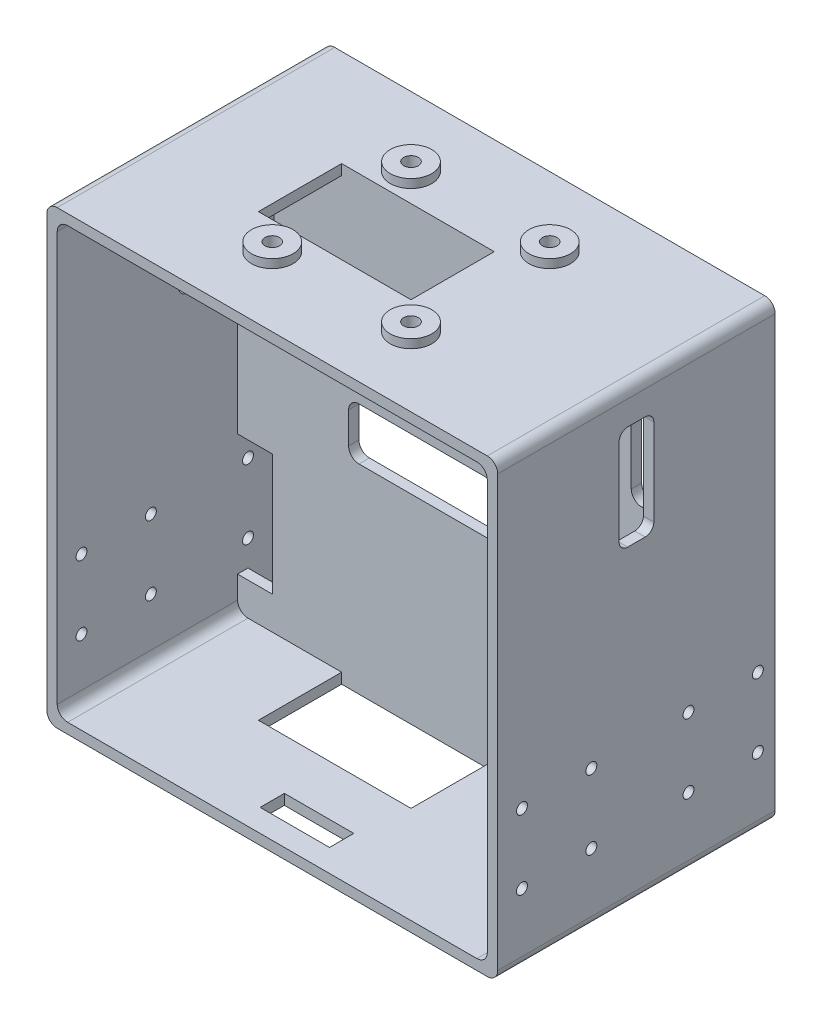
from build123d import *

# Parameters (mm, degrees)
SKETCH1_W           = 130
SKETCH1_H           = 130
SKETCH1_W_2         = 124
SKETCH1_H_2         = 124
BOSS_EXTRUDE1_DEPTH = 80
FILLET1_R           = 3
FILLET2_R           = 3
SKETCH2_W           = 44
SKETCH2_H           = 24
CUT_EXTRUDE1_DEPTH  = 166.90660023
SKETCH4_W           = 124
SKETCH4_H           = 124
BOSS_EXTRUDE4_DEPTH = 28
SKETCH3_W           = 124
SKETCH3_H           = 124
CUT_EXTRUDE2_DEPTH  = 25
FILLET3_R           = 3
SKETCH5_W           = 60
SKETCH5_H           = 15
CUT_EXTRUDE3_DEPTH  = 25
FILLET4_R           = 3
SKETCH7_W           = 10
SKETCH7_H           = 35
SKETCH7_W_2         = 7
SKETCH7_H_2         = 25
CUT_EXTRUDE4_DEPTH  = 108.121426428
FILLET6_R           = 3
CUT_EXTRUDE8_REACH  = 167.907
SKETCH8_R           = 1.575
CUT_EXTRUDE9_REACH  = 167.907
SKETCH10_R          = 1.575
SKETCH11_R          = 6
SKETCH11_R_2        = 2.1
BOSS_EXTRUDE5_DEPTH = 2.5
CUT_EXTRUDE11_REACH = 167.907
SKETCH13_R          = 2.1
SKETCH14_W          = 10
SKETCH14_H          = 30
CUT_EXTRUDE12_DEPTH = 167.901917305
FILLET7_R           = 2.5
FILLET8_R           = 2.5
CUT_EXTRUDE13_REACH = 169.873
SKETCH15_W          = 20
SKETCH15_H          = 7


with BuildPart() as part:
    # Sketch1 → Boss-Extrude1 (new body)
    with BuildSketch(Plane.XY):
        Rectangle(SKETCH1_W, SKETCH1_H)
        Rectangle(SKETCH1_W_2, SKETCH1_H_2, mode=Mode.SUBTRACT)
    extrude(amount=BOSS_EXTRUDE1_DEPTH)

    # Fillet1
    fillet1_edges = [part.edges().sort_by_distance(p)[0] for p in [
        (65, -65, 40),
        (-65, -65, 40),
        (-65, 65, 40),
        (65, 65, 40),
    ]]
    fillet(fillet1_edges, radius=FILLET1_R)

    # Fillet2
    fillet2_edges = [part.edges().sort_by_distance(p)[0] for p in [
        (62, -62, 40),
        (62, 62, 40),
        (-62, 62, 40),
        (-62, -62, 40),
    ]]
    fillet(fillet2_edges, radius=FILLET2_R)

    # Sketch2 → Cut-Extrude1 (cut, through all)
    with BuildSketch(Plane.XZ.offset(65)):
        with Locations((-10, 40)):
            Rectangle(SKETCH2_W, SKETCH2_H)
    extrude(amount=-CUT_EXTRUDE1_DEPTH, mode=Mode.SUBTRACT)

    # Sketch4 → Boss-Extrude4 (add)
    with BuildSketch(Plane(origin=(0, 0, 0), x_dir=(-1, 0, 0), z_dir=(0, 0, -1))):
        Rectangle(SKETCH4_W, SKETCH4_H)
    extrude(amount=-BOSS_EXTRUDE4_DEPTH)

    # Sketch3 → Cut-Extrude2 (cut)
    with BuildSketch(Plane(origin=(0, 0, 0), x_dir=(-1, 0, 0), z_dir=(0, 0, -1))):
        Rectangle(SKETCH3_W, SKETCH3_H)
    extrude(amount=-CUT_EXTRUDE2_DEPTH, mode=Mode.SUBTRACT)

    # Fillet3
    fillet3_edges = [part.edges().sort_by_distance(p)[0] for p in [
        (-62, 62, 12.5),
        (-62, -62, 12.5),
        (62, -62, 12.5),
        (62, 62, 12.5),
    ]]
    fillet(fillet3_edges, radius=FILLET3_R)

    # Sketch5 → Cut-Extrude3 (cut)
    with BuildSketch(Plane(origin=(0, 0, 25), x_dir=(-1, 0, 0), z_dir=(0, 0, -1))):
        Rectangle(SKETCH5_W, SKETCH5_H)
    extrude(amount=-CUT_EXTRUDE3_DEPTH, mode=Mode.SUBTRACT)

    # Fillet4
    fillet4_edges = [part.edges().sort_by_distance(p)[0] for p in [
        (-30, 7.5, 26.5),
        (-30, -7.5, 26.5),
        (30, -7.5, 26.5),
        (30, 7.5, 26.5),
    ]]
    fillet(fillet4_edges, radius=FILLET4_R)

    # Sketch7 → Cut-Extrude4 (cut, through all)
    with BuildSketch(Plane(origin=(0, 0, 25), x_dir=(-1, 0, 0), z_dir=(0, 0, -1))):
        with Locations((-57, -35)):
            Rectangle(SKETCH7_W, SKETCH7_H)
        with Locations((57, -35)):
            Rectangle(SKETCH7_W, SKETCH7_H)
        with Locations((55, 35)):
            Rectangle(SKETCH7_W_2, SKETCH7_H_2)
        with Locations((-55, 35)):
            Rectangle(SKETCH7_W_2, SKETCH7_H_2)
    extrude(amount=-CUT_EXTRUDE4_DEPTH, mode=Mode.SUBTRACT)

    # Fillet6
    fillet6_edges = [part.edges().sort_by_distance(p)[0] for p in [
        (-58.5, 47.5, 26.5),
        (-58.5, 22.5, 26.5),
        (-51.5, 22.5, 26.5),
        (-51.5, 47.5, 26.5),
        (51.5, 47.5, 26.5),
        (51.5, 22.5, 26.5),
        (58.5, 22.5, 26.5),
        (58.5, 47.5, 26.5),
    ]]
    fillet(fillet6_edges, radius=FILLET6_R)

    # Sketch8 → Cut-Extrude8 (cut, up to next)
    with BuildSketch(Plane(origin=(65, 0, 0), x_dir=(0, 0, -1), z_dir=(1, 0, 0)), mode=Mode.PRIVATE) as cut_extrude8_sk1:
        with Locations((-5, -25)):
            Circle(SKETCH8_R)
    cut_extrude8_tool1 = extrude(cut_extrude8_sk1.sketch, amount=-CUT_EXTRUDE8_REACH, mode=Mode.PRIVATE) & part.part
    # Sketch8 → Cut-Extrude8 (cut, up to next)
    with BuildSketch(Plane(origin=(65, 0, 0), x_dir=(0, 0, -1), z_dir=(1, 0, 0)), mode=Mode.PRIVATE) as cut_extrude8_sk2:
        with Locations((-5, -45)):
            Circle(SKETCH8_R)
    cut_extrude8_tool2 = extrude(cut_extrude8_sk2.sketch, amount=-CUT_EXTRUDE8_REACH, mode=Mode.PRIVATE) & part.part
    # Sketch8 → Cut-Extrude8 (cut, up to next)
    with BuildSketch(Plane(origin=(65, 0, 0), x_dir=(0, 0, -1), z_dir=(1, 0, 0)), mode=Mode.PRIVATE) as cut_extrude8_sk3:
        with Locations((-25, -25)):
            Circle(SKETCH8_R)
    cut_extrude8_tool3 = extrude(cut_extrude8_sk3.sketch, amount=-CUT_EXTRUDE8_REACH, mode=Mode.PRIVATE) & part.part
    # Sketch8 → Cut-Extrude8 (cut, up to next)
    with BuildSketch(Plane(origin=(65, 0, 0), x_dir=(0, 0, -1), z_dir=(1, 0, 0)), mode=Mode.PRIVATE) as cut_extrude8_sk4:
        with Locations((-25, -45)):
            Circle(SKETCH8_R)
    cut_extrude8_tool4 = extrude(cut_extrude8_sk4.sketch, amount=-CUT_EXTRUDE8_REACH, mode=Mode.PRIVATE) & part.part
    # Sketch8 → Cut-Extrude8 (cut, up to next)
    with BuildSketch(Plane(origin=(65, 0, 0), x_dir=(0, 0, -1), z_dir=(1, 0, 0)), mode=Mode.PRIVATE) as cut_extrude8_sk5:
        with Locations((-53, -25)):
            Circle(SKETCH8_R)
    cut_extrude8_tool5 = extrude(cut_extrude8_sk5.sketch, amount=-CUT_EXTRUDE8_REACH, mode=Mode.PRIVATE) & part.part
    # Sketch8 → Cut-Extrude8 (cut, up to next)
    with BuildSketch(Plane(origin=(65, 0, 0), x_dir=(0, 0, -1), z_dir=(1, 0, 0)), mode=Mode.PRIVATE) as cut_extrude8_sk6:
        with Locations((-53, -45)):
            Circle(SKETCH8_R)
    cut_extrude8_tool6 = extrude(cut_extrude8_sk6.sketch, amount=-CUT_EXTRUDE8_REACH, mode=Mode.PRIVATE) & part.part
    # Sketch8 → Cut-Extrude8 (cut, up to next)
    with BuildSketch(Plane(origin=(65, 0, 0), x_dir=(0, 0, -1), z_dir=(1, 0, 0)), mode=Mode.PRIVATE) as cut_extrude8_sk7:
        with Locations((-73, -25)):
            Circle(SKETCH8_R)
    cut_extrude8_tool7 = extrude(cut_extrude8_sk7.sketch, amount=-CUT_EXTRUDE8_REACH, mode=Mode.PRIVATE) & part.part
    # Sketch8 → Cut-Extrude8 (cut, up to next)
    with BuildSketch(Plane(origin=(65, 0, 0), x_dir=(0, 0, -1), z_dir=(1, 0, 0)), mode=Mode.PRIVATE) as cut_extrude8_sk8:
        with Locations((-73, -45)):
            Circle(SKETCH8_R)
    cut_extrude8_tool8 = extrude(cut_extrude8_sk8.sketch, amount=-CUT_EXTRUDE8_REACH, mode=Mode.PRIVATE) & part.part
    add(cut_extrude8_tool1.solids().sort_by_distance((65, -25, 5))[0], mode=Mode.SUBTRACT)
    add(cut_extrude8_tool2.solids().sort_by_distance((65, -45, 5))[0], mode=Mode.SUBTRACT)
    add(cut_extrude8_tool3.solids().sort_by_distance((65, -25, 25))[0], mode=Mode.SUBTRACT)
    add(cut_extrude8_tool4.solids().sort_by_distance((65, -45, 25))[0], mode=Mode.SUBTRACT)
    add(cut_extrude8_tool5.solids().sort_by_distance((65, -25, 53))[0], mode=Mode.SUBTRACT)
    add(cut_extrude8_tool6.solids().sort_by_distance((65, -45, 53))[0], mode=Mode.SUBTRACT)
    add(cut_extrude8_tool7.solids().sort_by_distance((65, -25, 73))[0], mode=Mode.SUBTRACT)
    add(cut_extrude8_tool8.solids().sort_by_distance((65, -45, 73))[0], mode=Mode.SUBTRACT)

    # Sketch10 → Cut-Extrude9 (cut, up to next)
    with BuildSketch(Plane.ZY.offset(65), mode=Mode.PRIVATE) as cut_extrude9_sk1:
        with Locations(Location((73, -25, 0), (0, 0, 180))):
            Circle(SKETCH10_R)
    cut_extrude9_tool1 = extrude(cut_extrude9_sk1.sketch, amount=-CUT_EXTRUDE9_REACH, mode=Mode.PRIVATE) & part.part
    # Sketch10 → Cut-Extrude9 (cut, up to next)
    with BuildSketch(Plane.ZY.offset(65), mode=Mode.PRIVATE) as cut_extrude9_sk2:
        with Locations(Location((73, -45, 0), (0, 0, 180))):
            Circle(SKETCH10_R)
    cut_extrude9_tool2 = extrude(cut_extrude9_sk2.sketch, amount=-CUT_EXTRUDE9_REACH, mode=Mode.PRIVATE) & part.part
    # Sketch10 → Cut-Extrude9 (cut, up to next)
    with BuildSketch(Plane.ZY.offset(65), mode=Mode.PRIVATE) as cut_extrude9_sk3:
        with Locations(Location((53, -25, 0), (0, 0, 180))):
            Circle(SKETCH10_R)
    cut_extrude9_tool3 = extrude(cut_extrude9_sk3.sketch, amount=-CUT_EXTRUDE9_REACH, mode=Mode.PRIVATE) & part.part
    # Sketch10 → Cut-Extrude9 (cut, up to next)
    with BuildSketch(Plane.ZY.offset(65), mode=Mode.PRIVATE) as cut_extrude9_sk4:
        with Locations(Location((53, -45, 0), (0, 0, 180))):
            Circle(SKETCH10_R)
    cut_extrude9_tool4 = extrude(cut_extrude9_sk4.sketch, amount=-CUT_EXTRUDE9_REACH, mode=Mode.PRIVATE) & part.part
    # Sketch10 → Cut-Extrude9 (cut, up to next)
    with BuildSketch(Plane.ZY.offset(65), mode=Mode.PRIVATE) as cut_extrude9_sk5:
        with Locations(Location((25, -25, 0), (0, 0, 180))):
            Circle(SKETCH10_R)
    cut_extrude9_tool5 = extrude(cut_extrude9_sk5.sketch, amount=-CUT_EXTRUDE9_REACH, mode=Mode.PRIVATE) & part.part
    # Sketch10 → Cut-Extrude9 (cut, up to next)
    with BuildSketch(Plane.ZY.offset(65), mode=Mode.PRIVATE) as cut_extrude9_sk6:
        with Locations(Location((25, -45, 0), (0, 0, 180))):
            Circle(SKETCH10_R)
    cut_extrude9_tool6 = extrude(cut_extrude9_sk6.sketch, amount=-CUT_EXTRUDE9_REACH, mode=Mode.PRIVATE) & part.part
    # Sketch10 → Cut-Extrude9 (cut, up to next)
    with BuildSketch(Plane.ZY.offset(65), mode=Mode.PRIVATE) as cut_extrude9_sk7:
        with Locations(Location((5, -25, 0), (0, 0, 180))):
            Circle(SKETCH10_R)
    cut_extrude9_tool7 = extrude(cut_extrude9_sk7.sketch, amount=-CUT_EXTRUDE9_REACH, mode=Mode.PRIVATE) & part.part
    # Sketch10 → Cut-Extrude9 (cut, up to next)
    with BuildSketch(Plane.ZY.offset(65), mode=Mode.PRIVATE) as cut_extrude9_sk8:
        with Locations(Location((5, -45, 0), (0, 0, 180))):
            Circle(SKETCH10_R)
    cut_extrude9_tool8 = extrude(cut_extrude9_sk8.sketch, amount=-CUT_EXTRUDE9_REACH, mode=Mode.PRIVATE) & part.part
    add(cut_extrude9_tool1.solids().sort_by_distance((-65, -25, 73))[0], mode=Mode.SUBTRACT)
    add(cut_extrude9_tool2.solids().sort_by_distance((-65, -45, 73))[0], mode=Mode.SUBTRACT)
    add(cut_extrude9_tool3.solids().sort_by_distance((-65, -25, 53))[0], mode=Mode.SUBTRACT)
    add(cut_extrude9_tool4.solids().sort_by_distance((-65, -45, 53))[0], mode=Mode.SUBTRACT)
    add(cut_extrude9_tool5.solids().sort_by_distance((-65, -25, 25))[0], mode=Mode.SUBTRACT)
    add(cut_extrude9_tool6.solids().sort_by_distance((-65, -45, 25))[0], mode=Mode.SUBTRACT)
    add(cut_extrude9_tool7.solids().sort_by_distance((-65, -25, 5))[0], mode=Mode.SUBTRACT)
    add(cut_extrude9_tool8.solids().sort_by_distance((-65, -45, 5))[0], mode=Mode.SUBTRACT)

    # Sketch11 → Boss-Extrude5 (add)
    # profile 1 of 4: a face of its own
    with BuildSketch(Plane(origin=(0, 65, 0), x_dir=(1, 0, 0), z_dir=(0, 1, 0))):
        with Locations(Location((-20, -20, 0), (0, 0, 90))):
            Circle(SKETCH11_R)
        with Locations(Location((-20, -20, 0), (0, 0, 270))):
            Circle(SKETCH11_R_2, mode=Mode.SUBTRACT)
    # profile 2 of 4: a face of its own
    with BuildSketch(Plane(origin=(0, 65, 0), x_dir=(1, 0, 0), z_dir=(0, 1, 0))):
        with Locations(Location((20, -20, 0), (0, 0, 90))):
            Circle(SKETCH11_R)
        with Locations(Location((20, -20, 0), (0, 0, 270))):
            Circle(SKETCH11_R_2, mode=Mode.SUBTRACT)
    # profile 3 of 4: a face of its own
    with BuildSketch(Plane(origin=(0, 65, 0), x_dir=(1, 0, 0), z_dir=(0, 1, 0))):
        with Locations(Location((20, -60, 0), (0, 0, 90))):
            Circle(SKETCH11_R)
        with Locations(Location((20, -60, 0), (0, 0, 270))):
            Circle(SKETCH11_R_2, mode=Mode.SUBTRACT)
    # profile 4 of 4: a face of its own
    with BuildSketch(Plane(origin=(0, 65, 0), x_dir=(1, 0, 0), z_dir=(0, 1, 0))):
        with Locations(Location((-20, -60, 0), (0, 0, 90))):
            Circle(SKETCH11_R)
        with Locations(Location((-20, -60, 0), (0, 0, 270))):
            Circle(SKETCH11_R_2, mode=Mode.SUBTRACT)
    extrude(amount=BOSS_EXTRUDE5_DEPTH)

    # Sketch13 → Cut-Extrude11 (cut, up to next)
    with BuildSketch(Plane(origin=(0, 65, 0), x_dir=(1, 0, 0), z_dir=(0, 1, 0)), mode=Mode.PRIVATE) as cut_extrude11_sk1:
        with Locations(Location((-20, -20, 0), (0, 0, 270))):
            Circle(SKETCH13_R)
    cut_extrude11_tool1 = extrude(cut_extrude11_sk1.sketch, amount=-CUT_EXTRUDE11_REACH, mode=Mode.PRIVATE) & part.part
    # Sketch13 → Cut-Extrude11 (cut, up to next)
    with BuildSketch(Plane(origin=(0, 65, 0), x_dir=(1, 0, 0), z_dir=(0, 1, 0)), mode=Mode.PRIVATE) as cut_extrude11_sk2:
        with Locations(Location((20, -20, 0), (0, 0, 270))):
            Circle(SKETCH13_R)
    cut_extrude11_tool2 = extrude(cut_extrude11_sk2.sketch, amount=-CUT_EXTRUDE11_REACH, mode=Mode.PRIVATE) & part.part
    # Sketch13 → Cut-Extrude11 (cut, up to next)
    with BuildSketch(Plane(origin=(0, 65, 0), x_dir=(1, 0, 0), z_dir=(0, 1, 0)), mode=Mode.PRIVATE) as cut_extrude11_sk3:
        with Locations(Location((20, -60, 0), (0, 0, 90))):
            Circle(SKETCH13_R)
    cut_extrude11_tool3 = extrude(cut_extrude11_sk3.sketch, amount=-CUT_EXTRUDE11_REACH, mode=Mode.PRIVATE) & part.part
    # Sketch13 → Cut-Extrude11 (cut, up to next)
    with BuildSketch(Plane(origin=(0, 65, 0), x_dir=(1, 0, 0), z_dir=(0, 1, 0)), mode=Mode.PRIVATE) as cut_extrude11_sk4:
        with Locations(Location((-20, -60, 0), (0, 0, 90))):
            Circle(SKETCH13_R)
    cut_extrude11_tool4 = extrude(cut_extrude11_sk4.sketch, amount=-CUT_EXTRUDE11_REACH, mode=Mode.PRIVATE) & part.part
    add(cut_extrude11_tool1.solids().sort_by_distance((-20, 65, 20))[0], mode=Mode.SUBTRACT)
    add(cut_extrude11_tool2.solids().sort_by_distance((20, 65, 20))[0], mode=Mode.SUBTRACT)
    add(cut_extrude11_tool3.solids().sort_by_distance((20, 65, 60))[0], mode=Mode.SUBTRACT)
    add(cut_extrude11_tool4.solids().sort_by_distance((-20, 65, 60))[0], mode=Mode.SUBTRACT)

    # Sketch14 → Cut-Extrude12 (cut, through all)
    with BuildSketch(Plane(origin=(65, 0, 0), x_dir=(0, 0, -1), z_dir=(1, 0, 0))):
        with Locations((-40, 40)):
            Rectangle(SKETCH14_W, SKETCH14_H)
    extrude(amount=-CUT_EXTRUDE12_DEPTH, mode=Mode.SUBTRACT)

    # Fillet7
    fillet7_edges = [part.edges().sort_by_distance(p)[0] for p in [
        (63.5, 55, 35),
        (63.5, 25, 35),
        (63.5, 25, 45),
        (63.5, 55, 45),
    ]]
    fillet(fillet7_edges, radius=FILLET7_R)

    # Fillet8
    fillet8_edges = [part.edges().sort_by_distance(p)[0] for p in [
        (-63.5, 55, 35),
        (-63.5, 25, 35),
        (-63.5, 25, 45),
        (-63.5, 55, 45),
    ]]
    fillet(fillet8_edges, radius=FILLET8_R)

    # Sketch15 → Cut-Extrude13 (cut, up to next)
    with BuildSketch(Plane(origin=(0, -65, 0), x_dir=(-1, 0, 0), z_dir=(0, -1, 0)), mode=Mode.PRIVATE) as cut_extrude13_sk1:
        with Locations((0, -70)):
            Rectangle(SKETCH15_W, SKETCH15_H)
    cut_extrude13_tool1 = extrude(cut_extrude13_sk1.sketch, amount=-CUT_EXTRUDE13_REACH, mode=Mode.PRIVATE) & part.part
    add(cut_extrude13_tool1.solids().sort_by_distance((0, -65, 70))[0], mode=Mode.SUBTRACT)


solid = part.part
